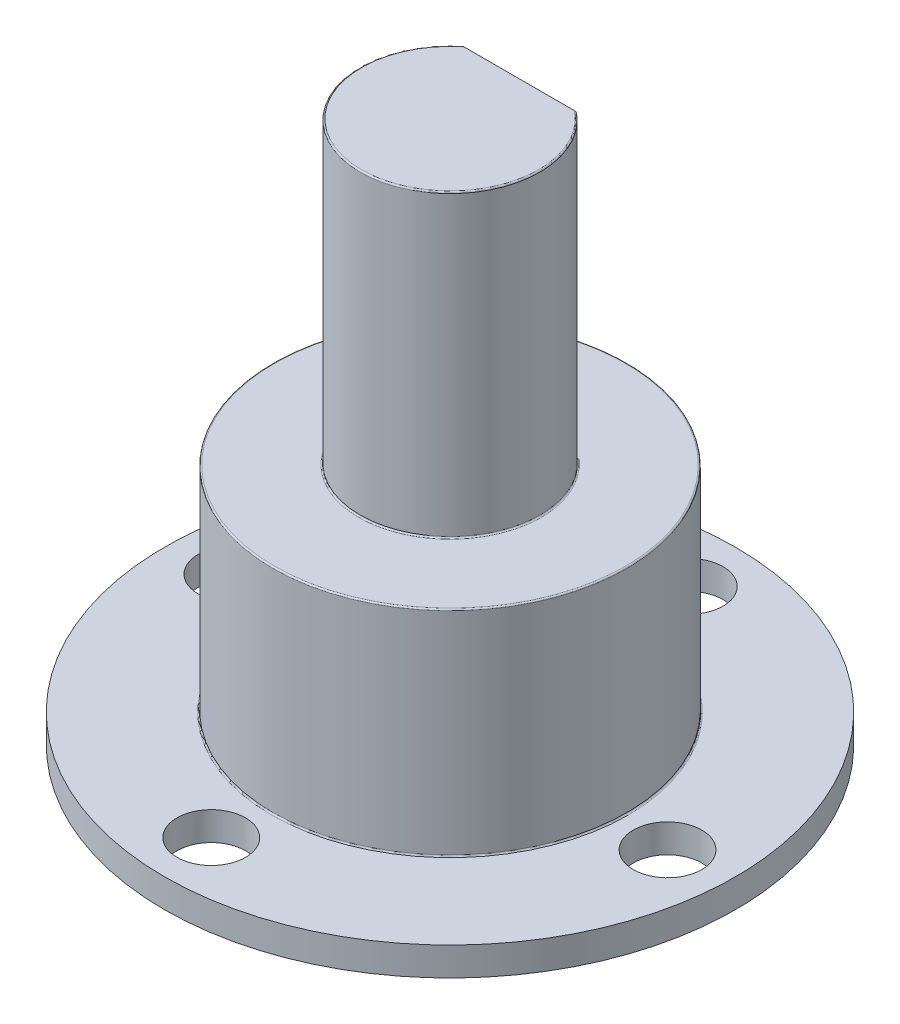
from build123d import *

# Parameters (mm, degrees)
ESQUISSE3_W                  = 6.57785754
ESQUISSE3_H                  = 1.386048805
ENL_V_MAT_EXTRU_1_DEPTH      = 10.5
D_GAGEMENT_M21_D             = 2.4
R_P_TITION_CIRCULAIRE1_COUNT = 4
CONG_1_R                     = 0.05


with BuildPart() as part:
    # Esquisse2 → Révolution2 (revolve)
    with BuildSketch(Plane.XY, mode=Mode.PRIVATE) as r_volution2_sk:
        Polygon((0, 19), (3.15, 19), (3.15, 8.5), (6.2, 8.5), (6.2, 3), (6.2, 1), (10, 1), (10, 0), (0, 0), align=None)
    revolve(r_volution2_sk.sketch.rotate(Axis((0, 0, 0), (0, 1, 0)), 90), axis=Axis((0, 0, 0), (0, 1, 0)))

    # Esquisse3 → Enlèv. mat.-Extru.1 (cut)
    with BuildSketch(Plane(origin=(0, 19, 0), x_dir=(1, 0, 0), z_dir=(0, 1, 0))):
        with Locations((-0.352413472, 3.114928535)):
            Rectangle(ESQUISSE3_W, ESQUISSE3_H)
    extrude(amount=-ENL_V_MAT_EXTRU_1_DEPTH, mode=Mode.SUBTRACT)

    # Dégagement M21 (through all)
    with Locations(Plane(origin=(0, 1, 0), x_dir=(1, 0, 0), z_dir=(0, 1, 0))):
        with Locations((0.371303159, 7.991378727)):
            d_gagement_m21 = Hole(D_GAGEMENT_M21_D / 2)

    # Répétition circulaire1: Dégagement M21 ×4 about axis
    r_p_tition_circulaire1_axis = Axis((0, 0, 0), (0, 1, 0))
    for i in range(1, R_P_TITION_CIRCULAIRE1_COUNT):
        add(d_gagement_m21.rotate(r_p_tition_circulaire1_axis, i * 360 / R_P_TITION_CIRCULAIRE1_COUNT), mode=Mode.SUBTRACT)

    # Congé1
    cong_1_edges = [part.edges().sort_by_distance(p)[0] for p in [
        (0, 1, 6.2),
        (0, 8.5, 6.2),
        (0, 8.5, 3.15),
        (0, 19, 3.15),
    ]]
    fillet(cong_1_edges, radius=CONG_1_R)


solid = part.part
